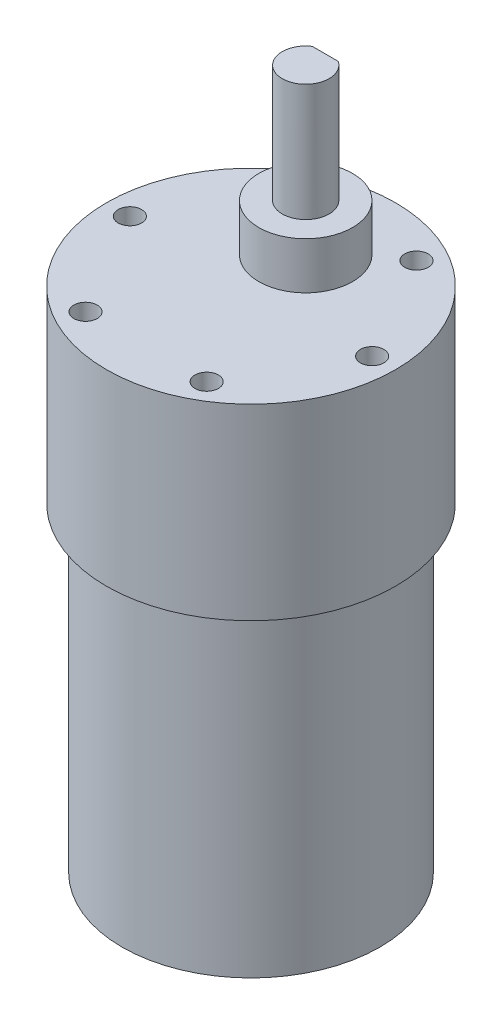
from build123d import *

# Parameters (mm, degrees)
SKETCH1_R           = 16.5
BOSS_EXTRUDE1_DEPTH = 41
SKETCH2_R           = 18.5
BOSS_EXTRUDE2_DEPTH = 24
SKETCH3_R           = 6
BOSS_EXTRUDE3_DEPTH = 6
SKETCH4_R           = 3
BOSS_EXTRUDE4_DEPTH = 15
SKETCH5_W           = 8.086329314
SKETCH5_H           = 5.281822038
CUT_EXTRUDE1_DEPTH  = 12
SKETCH6_R           = 1.5
CUT_EXTRUDE2_DEPTH  = 3


with BuildPart() as part:
    # Sketch1 → Boss-Extrude1 (new body)
    with BuildSketch(Plane(origin=(0, 0, 0), x_dir=(1, 0, 0), z_dir=(0, 1, 0))):
        with Locations(Location((0, 0, 0), (0, 0, 270))):
            Circle(SKETCH1_R)
    extrude(amount=BOSS_EXTRUDE1_DEPTH)

    # Sketch2 → Boss-Extrude2 (add)
    with BuildSketch(Plane(origin=(0, 41, 0), x_dir=(1, 0, 0), z_dir=(0, 1, 0))):
        with Locations(Location((0, 0, 0), (0, 0, 270))):
            Circle(SKETCH2_R)
    extrude(amount=BOSS_EXTRUDE2_DEPTH)

    # Sketch3 → Boss-Extrude3 (add)
    with BuildSketch(Plane(origin=(0, 65, 0), x_dir=(1, 0, 0), z_dir=(0, 1, 0))):
        with Locations(Location((0, 7, 0), (0, 0, 270))):
            Circle(SKETCH3_R)
    extrude(amount=BOSS_EXTRUDE3_DEPTH)

    # Sketch4 → Boss-Extrude4 (add)
    with BuildSketch(Plane(origin=(0, 71, 0), x_dir=(1, 0, 0), z_dir=(0, 1, 0))):
        with Locations(Location((0, 7, 0), (0, 0, 270))):
            Circle(SKETCH4_R)
    extrude(amount=BOSS_EXTRUDE4_DEPTH)

    # Sketch5 → Cut-Extrude1 (cut)
    with BuildSketch(Plane(origin=(0, 86, 0), x_dir=(1, 0, 0), z_dir=(0, 1, 0))):
        with Locations((0.101264993, 12.140911019)):
            Rectangle(SKETCH5_W, SKETCH5_H)
    extrude(amount=-CUT_EXTRUDE1_DEPTH, mode=Mode.SUBTRACT)

    # Sketch6 → Cut-Extrude2 (cut)
    with BuildSketch(Plane(origin=(0, 65, 0), x_dir=(1, 0, 0), z_dir=(0, 1, 0))):
        with Locations(Location((-15.5, 0, 0), (0, 0, 270))):
            Circle(SKETCH6_R)
        with Locations(Location((-7.75, 13.423393759, 0), (0, 0, 270))):
            Circle(SKETCH6_R)
        with Locations(Location((7.75, 13.423393759, 0), (0, 0, 270))):
            Circle(SKETCH6_R)
        with Locations(Location((15.5, 0, 0), (0, 0, 270))):
            Circle(SKETCH6_R)
        with Locations(Location((7.75, -13.423393759, 0), (0, 0, 270))):
            Circle(SKETCH6_R)
        with Locations(Location((-7.75, -13.423393759, 0), (0, 0, 270))):
            Circle(SKETCH6_R)
    extrude(amount=-CUT_EXTRUDE2_DEPTH, mode=Mode.SUBTRACT)


solid = part.part
